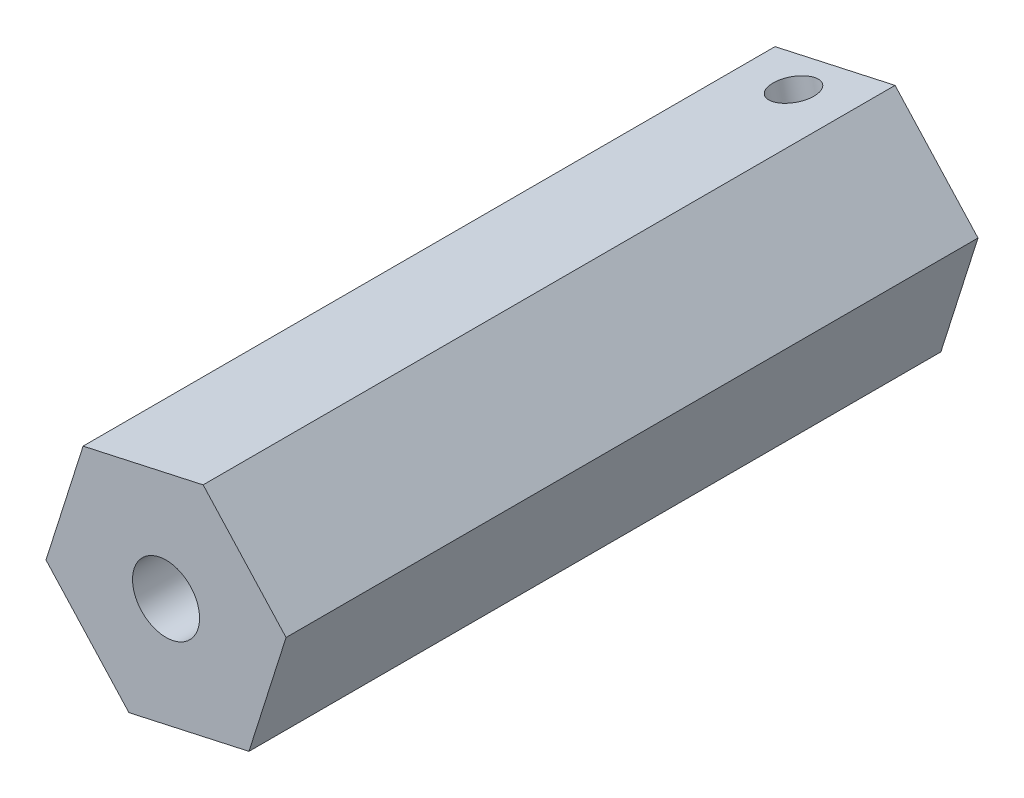
from build123d import *

# Parameters (mm, degrees)
SKETCH1_R             = 2.00000108
BOSS_EXTRUDE1_DEPTH   = 41.275
M3_TAPPED_HOLE1_D     = 2.5
M3_TAPPED_HOLE1_DEPTH = 6.35
M3_TAPPED_HOLE1_TIP   = 0.751075774


with BuildPart() as part:
    # Sketch1 → Boss-Extrude1 (new body)
    with BuildSketch(Plane.XY):
        Polygon((2.213234223, 6.990345314), (-4.947199511, 5.411889719), (-7.160433735, -1.578455595), (-2.213234223, -6.990345314), (4.947199511, -5.411889719), (7.160433735, 1.578455595), align=None)
        Circle(SKETCH1_R, mode=Mode.SUBTRACT)
    extrude(amount=BOSS_EXTRUDE1_DEPTH)

    # M3 Tapped Hole1
    with Locations(Plane(origin=(-1.394683733, 6.195011051, 2.448450975), x_dir=(0.976553939578, 0.21527285731, 0), z_dir=(-0.21527285731, 0.976553939578, 0))):
        with Locations((0, 0)):
            Hole(M3_TAPPED_HOLE1_D / 2, depth=M3_TAPPED_HOLE1_DEPTH)
            with Locations((0, 0, -(M3_TAPPED_HOLE1_DEPTH + M3_TAPPED_HOLE1_TIP / 2))):  # 118° drill point
                Cone(0, M3_TAPPED_HOLE1_D / 2, M3_TAPPED_HOLE1_TIP, mode=Mode.SUBTRACT)


solid = part.part
